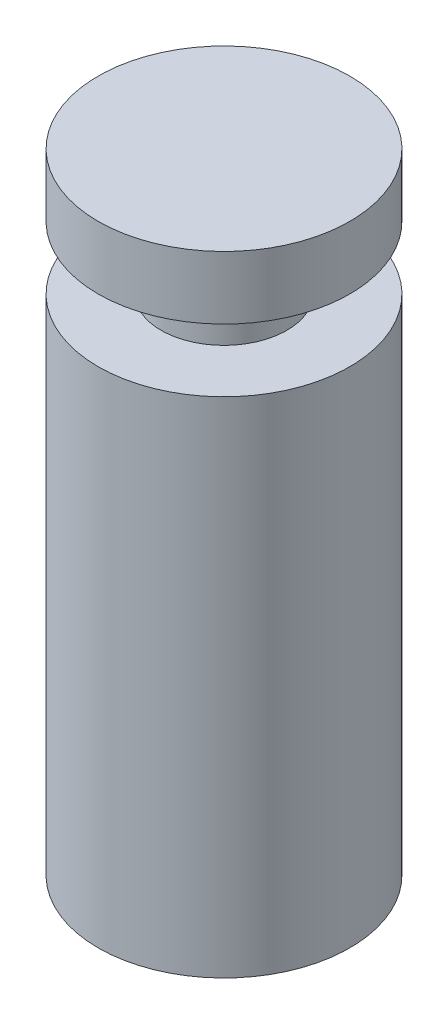
from build123d import *


with BuildPart() as part:
    # Croquis2 → Revolución1 (revolve)
    with BuildSketch(Plane(origin=(0, 0, 0), x_dir=(0, 0, -1), z_dir=(1, 0, 0))):
        Polygon((0, 0), (0, 20), (4, 20), (4, 18), (2, 18), (2, 16), (4, 16), (4, 0), align=None)
    revolve(axis=Axis((0, 0, 0), (0, 1, 0)))


solid = part.part
